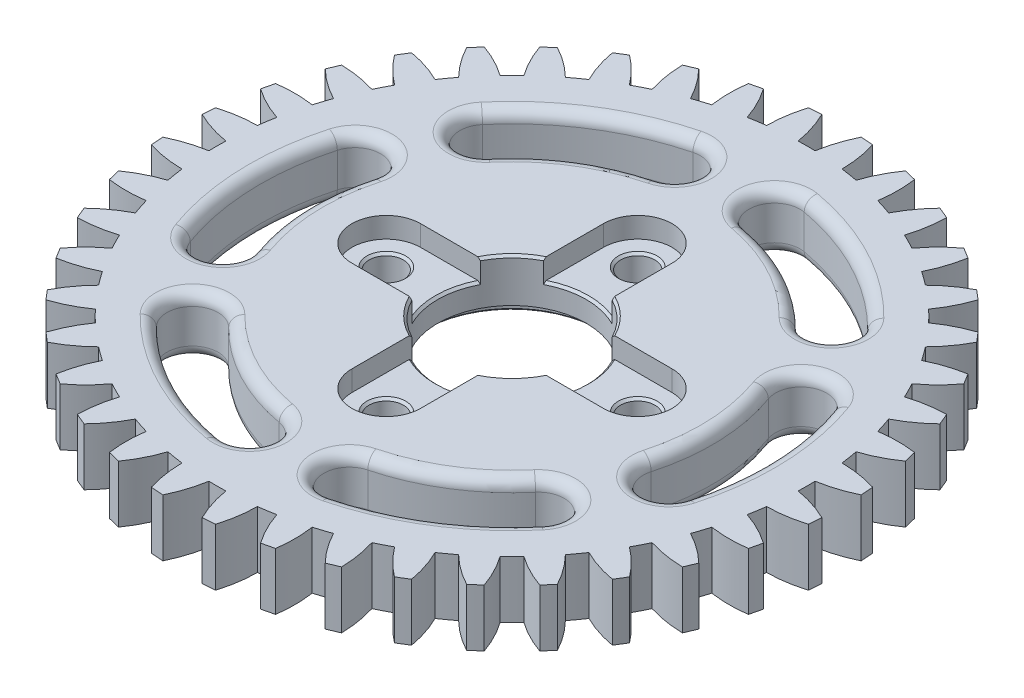
from build123d import *

# Parameters (mm, degrees)
SKETCH_2_R          = 1.5
SKETCH_2_R_2        = 6.5
EXTRUDE_2_DEPTH     = 5
CUT_EXTRUDE_1_DEPTH = 1.8
SKETCH_4_R          = 7.6
CUT_EXTRUDE_2_DEPTH = 1.2
CHAMFER_1_SIZE      = 0.2
FILLET_2_R          = 1


with BuildPart() as part:
    # 草图2 → 凸台-拉伸2 (new body)
    with BuildSketch(Plane(origin=(0, 0, 0), x_dir=(1, 0, 0), z_dir=(0, 1, 0))):
        with BuildLine():
            ThreePointArc((-0.73985828, 25.769631348), (-1.118469833, 27.332605136), (-1.7209274, 28.823671416))
            ThreePointArc((-1.7209274, 28.823671416), (-2.265506389, 28.785988012), (-2.80927569, 28.738016548))
            ThreePointArc((-2.80927569, 28.738016548), (-3.17106185, 27.171062641), (-3.300509097, 25.568103758))
            ThreePointArc((-3.300509097, 25.568103758), (-4.032919617, 25.462852343), (-4.762007891, 25.336625089))
            ThreePointArc((-4.762007891, 25.336625089), (-5.380461076, 26.821128181), (-6.208755546, 28.199591833))
            ThreePointArc((-6.208755546, 28.199591833), (-6.740734881, 28.077181451), (-7.27030509, 27.944736336))
            ThreePointArc((-7.27030509, 27.944736336), (-7.382511465, 26.340478408), (-7.259606987, 24.737004598))
            ThreePointArc((-7.259606987, 24.737004598), (-7.966535369, 24.518474754), (-8.666901064, 24.279747034))
            ThreePointArc((-8.666901064, 24.279747034), (-9.50996751, 25.649226036), (-10.543703526, 26.881144711))
            ThreePointArc((-10.543703526, 26.881144711), (-11.04998411, 26.677021501), (-11.552315449, 26.463363973))
            ThreePointArc((-11.552315449, 26.463363973), (-11.412179147, 24.861304177), (-11.039949259, 23.296798287))
            ThreePointArc((-11.039949259, 23.296798287), (-11.703988581, 22.970370945), (-12.358386368, 22.625021026))
            ThreePointArc((-12.358386368, 22.625021026), (-13.405306983, 23.845754821), (-14.619030531, 24.900794592))
            ThreePointArc((-14.619030531, 24.900794592), (-15.087146056, 24.619984746), (-15.549869462, 24.330375762))
            ThreePointArc((-15.549869462, 24.330375762), (-15.160841103, 22.769962128), (-14.548451341, 21.282947485))
            ThreePointArc((-14.548451341, 21.282947485), (-15.15325075, 20.856660369), (-15.745567185, 20.413191913))
            ThreePointArc((-15.745567185, 20.413191913), (-16.970563308, 21.455121983), (-18.334388488, 22.30730427))
            ThreePointArc((-18.334388488, 22.30730427), (-18.752812396, 21.956722257), (-19.164534082, 21.598292951))
            ThreePointArc((-19.164534082, 21.598292951), (-18.536192836, 20.117948042), (-17.698722268, 18.745039881))
            ThreePointArc((-17.698722268, 18.745039881), (-18.229389596, 18.229389596), (-18.745039881, 17.698722268))
            ThreePointArc((-18.745039881, 17.698722268), (-20.117948042, 18.536192836), (-21.598292951, 19.164534082))
            ThreePointArc((-21.598292951, 19.164534082), (-21.956722257, 18.752812396), (-22.30730427, 18.334388488))
            ThreePointArc((-22.30730427, 18.334388488), (-21.455121983, 16.970563308), (-20.413191913, 15.745567185))
            ThreePointArc((-20.413191913, 15.745567185), (-20.856660369, 15.15325075), (-21.282947485, 14.548451341))
            ThreePointArc((-21.282947485, 14.548451341), (-22.769962128, 15.160841103), (-24.330375762, 15.549869462))
            ThreePointArc((-24.330375762, 15.549869462), (-24.619984746, 15.087146056), (-24.900794592, 14.619030531))
            ThreePointArc((-24.900794592, 14.619030531), (-23.845754821, 13.405306983), (-22.625021026, 12.358386368))
            ThreePointArc((-22.625021026, 12.358386368), (-22.970370945, 11.703988581), (-23.296798287, 11.039949259))
            ThreePointArc((-23.296798287, 11.039949259), (-24.861304177, 11.412179147), (-26.463363973, 11.552315449))
            ThreePointArc((-26.463363973, 11.552315449), (-26.677021501, 11.04998411), (-26.881144711, 10.543703526))
            ThreePointArc((-26.881144711, 10.543703526), (-25.649226036, 9.50996751), (-24.279747034, 8.666901064))
            ThreePointArc((-24.279747034, 8.666901064), (-24.518474754, 7.966535369), (-24.737004598, 7.259606987))
            ThreePointArc((-24.737004598, 7.259606987), (-26.340478408, 7.382511465), (-27.944736336, 7.27030509))
            ThreePointArc((-27.944736336, 7.27030509), (-28.077181451, 6.740734881), (-28.199591833, 6.208755546))
            ThreePointArc((-28.199591833, 6.208755546), (-26.821128181, 5.380461076), (-25.336625089, 4.762007891))
            ThreePointArc((-25.336625089, 4.762007891), (-25.462852343, 4.032919617), (-25.568103758, 3.300509097))
            ThreePointArc((-25.568103758, 3.300509097), (-27.171062641, 3.17106185), (-28.738016548, 2.80927569))
            ThreePointArc((-28.738016548, 2.80927569), (-28.785988012, 2.265506389), (-28.823671416, 1.7209274))
            ThreePointArc((-28.823671416, 1.7209274), (-27.332605136, 1.118469833), (-25.769631348, 0.73985828))
            ThreePointArc((-25.769631348, 0.73985828), (-25.78025, 0), (-25.769631348, -0.73985828))
            ThreePointArc((-25.769631348, -0.73985828), (-27.332605136, -1.118469833), (-28.823671416, -1.7209274))
            ThreePointArc((-28.823671416, -1.7209274), (-28.785988012, -2.265506389), (-28.738016548, -2.80927569))
            ThreePointArc((-28.738016548, -2.80927569), (-27.171062641, -3.17106185), (-25.568103758, -3.300509097))
            ThreePointArc((-25.568103758, -3.300509097), (-25.462852343, -4.032919617), (-25.336625089, -4.762007891))
            ThreePointArc((-25.336625089, -4.762007891), (-26.821128181, -5.380461076), (-28.199591833, -6.208755546))
            ThreePointArc((-28.199591833, -6.208755546), (-28.077181451, -6.740734881), (-27.944736336, -7.27030509))
            ThreePointArc((-27.944736336, -7.27030509), (-26.340478408, -7.382511465), (-24.737004598, -7.259606987))
            ThreePointArc((-24.737004598, -7.259606987), (-24.518474754, -7.966535369), (-24.279747034, -8.666901064))
            ThreePointArc((-24.279747034, -8.666901064), (-25.649226036, -9.50996751), (-26.881144711, -10.543703526))
            ThreePointArc((-26.881144711, -10.543703526), (-26.677021501, -11.04998411), (-26.463363973, -11.552315449))
            ThreePointArc((-26.463363973, -11.552315449), (-24.861304177, -11.412179147), (-23.296798287, -11.039949259))
            ThreePointArc((-23.296798287, -11.039949259), (-22.970370945, -11.703988581), (-22.625021026, -12.358386368))
            ThreePointArc((-22.625021026, -12.358386368), (-23.845754821, -13.405306983), (-24.900794592, -14.619030531))
            ThreePointArc((-24.900794592, -14.619030531), (-24.619984746, -15.087146056), (-24.330375762, -15.549869462))
            ThreePointArc((-24.330375762, -15.549869462), (-22.769962128, -15.160841103), (-21.282947485, -14.548451341))
            ThreePointArc((-21.282947485, -14.548451341), (-20.856660369, -15.15325075), (-20.413191913, -15.745567185))
            ThreePointArc((-20.413191913, -15.745567185), (-21.455121983, -16.970563308), (-22.30730427, -18.334388488))
            ThreePointArc((-22.30730427, -18.334388488), (-21.956722257, -18.752812396), (-21.598292951, -19.164534082))
            ThreePointArc((-21.598292951, -19.164534082), (-20.117948042, -18.536192836), (-18.745039881, -17.698722268))
            ThreePointArc((-18.745039881, -17.698722268), (-18.229389596, -18.229389596), (-17.698722268, -18.745039881))
            ThreePointArc((-17.698722268, -18.745039881), (-18.536192836, -20.117948042), (-19.164534082, -21.598292951))
            ThreePointArc((-19.164534082, -21.598292951), (-18.752812396, -21.956722257), (-18.334388488, -22.30730427))
            ThreePointArc((-18.334388488, -22.30730427), (-16.970563308, -21.455121983), (-15.745567185, -20.413191913))
            ThreePointArc((-15.745567185, -20.413191913), (-15.15325075, -20.856660369), (-14.548451341, -21.282947485))
            ThreePointArc((-14.548451341, -21.282947485), (-15.160841103, -22.769962128), (-15.549869462, -24.330375762))
            ThreePointArc((-15.549869462, -24.330375762), (-15.087146056, -24.619984746), (-14.619030531, -24.900794592))
            ThreePointArc((-14.619030531, -24.900794592), (-13.405306983, -23.845754821), (-12.358386368, -22.625021026))
            ThreePointArc((-12.358386368, -22.625021026), (-11.703988581, -22.970370945), (-11.039949259, -23.296798287))
            ThreePointArc((-11.039949259, -23.296798287), (-11.412179147, -24.861304177), (-11.552315449, -26.463363973))
            ThreePointArc((-11.552315449, -26.463363973), (-11.04998411, -26.677021501), (-10.543703526, -26.881144711))
            ThreePointArc((-10.543703526, -26.881144711), (-9.50996751, -25.649226036), (-8.666901064, -24.279747034))
            ThreePointArc((-8.666901064, -24.279747034), (-7.966535369, -24.518474754), (-7.259606987, -24.737004598))
            ThreePointArc((-7.259606987, -24.737004598), (-7.382511465, -26.340478408), (-7.27030509, -27.944736336))
            ThreePointArc((-7.27030509, -27.944736336), (-6.740734881, -28.077181451), (-6.208755546, -28.199591833))
            ThreePointArc((-6.208755546, -28.199591833), (-5.380461076, -26.821128181), (-4.762007891, -25.336625089))
            ThreePointArc((-4.762007891, -25.336625089), (-4.032919617, -25.462852343), (-3.300509097, -25.568103758))
            ThreePointArc((-3.300509097, -25.568103758), (-3.17106185, -27.171062641), (-2.80927569, -28.738016548))
            ThreePointArc((-2.80927569, -28.738016548), (-2.265506389, -28.785988012), (-1.7209274, -28.823671416))
            ThreePointArc((-1.7209274, -28.823671416), (-1.118469833, -27.332605136), (-0.73985828, -25.769631348))
            ThreePointArc((-0.73985828, -25.769631348), (0, -25.78025), (0.73985828, -25.769631348))
            ThreePointArc((0.73985828, -25.769631348), (1.118469833, -27.332605136), (1.7209274, -28.823671416))
            ThreePointArc((1.7209274, -28.823671416), (2.265506389, -28.785988012), (2.80927569, -28.738016548))
            ThreePointArc((2.80927569, -28.738016548), (3.17106185, -27.171062641), (3.300509097, -25.568103758))
            ThreePointArc((3.300509097, -25.568103758), (4.032919617, -25.462852343), (4.762007891, -25.336625089))
            ThreePointArc((4.762007891, -25.336625089), (5.380461076, -26.821128181), (6.208755546, -28.199591833))
            ThreePointArc((6.208755546, -28.199591833), (6.740734881, -28.077181451), (7.27030509, -27.944736336))
            ThreePointArc((7.27030509, -27.944736336), (7.382511465, -26.340478408), (7.259606987, -24.737004598))
            ThreePointArc((7.259606987, -24.737004598), (7.966535369, -24.518474754), (8.666901064, -24.279747034))
            ThreePointArc((8.666901064, -24.279747034), (9.50996751, -25.649226036), (10.543703526, -26.881144711))
            ThreePointArc((10.543703526, -26.881144711), (11.04998411, -26.677021501), (11.552315449, -26.463363973))
            ThreePointArc((11.552315449, -26.463363973), (11.412179147, -24.861304177), (11.039949259, -23.296798287))
            ThreePointArc((11.039949259, -23.296798287), (11.703988581, -22.970370945), (12.358386368, -22.625021026))
            ThreePointArc((12.358386368, -22.625021026), (13.405306983, -23.845754821), (14.619030531, -24.900794592))
            ThreePointArc((14.619030531, -24.900794592), (15.087146056, -24.619984746), (15.549869462, -24.330375762))
            ThreePointArc((15.549869462, -24.330375762), (15.160841103, -22.769962128), (14.548451341, -21.282947485))
            ThreePointArc((14.548451341, -21.282947485), (15.15325075, -20.856660369), (15.745567185, -20.413191913))
            ThreePointArc((15.745567185, -20.413191913), (16.970563308, -21.455121983), (18.334388488, -22.30730427))
            ThreePointArc((18.334388488, -22.30730427), (18.752812396, -21.956722257), (19.164534082, -21.598292951))
            ThreePointArc((19.164534082, -21.598292951), (18.536192836, -20.117948042), (17.698722268, -18.745039881))
            ThreePointArc((17.698722268, -18.745039881), (18.229389596, -18.229389596), (18.745039881, -17.698722268))
            ThreePointArc((18.745039881, -17.698722268), (20.117948042, -18.536192836), (21.598292951, -19.164534082))
            ThreePointArc((21.598292951, -19.164534082), (21.956722257, -18.752812396), (22.30730427, -18.334388488))
            ThreePointArc((22.30730427, -18.334388488), (21.455121983, -16.970563308), (20.413191913, -15.745567185))
            ThreePointArc((20.413191913, -15.745567185), (20.856660369, -15.15325075), (21.282947485, -14.548451341))
            ThreePointArc((21.282947485, -14.548451341), (22.769962128, -15.160841103), (24.330375762, -15.549869462))
            ThreePointArc((24.330375762, -15.549869462), (24.619984746, -15.087146056), (24.900794592, -14.619030531))
            ThreePointArc((24.900794592, -14.619030531), (23.845754821, -13.405306983), (22.625021026, -12.358386368))
            ThreePointArc((22.625021026, -12.358386368), (22.970370945, -11.703988581), (23.296798287, -11.039949259))
            ThreePointArc((23.296798287, -11.039949259), (24.861304177, -11.412179147), (26.463363973, -11.552315449))
            ThreePointArc((26.463363973, -11.552315449), (26.677021501, -11.04998411), (26.881144711, -10.543703526))
            ThreePointArc((26.881144711, -10.543703526), (25.649226036, -9.50996751), (24.279747034, -8.666901064))
            ThreePointArc((24.279747034, -8.666901064), (24.518474754, -7.966535369), (24.737004598, -7.259606987))
            ThreePointArc((24.737004598, -7.259606987), (26.340478408, -7.382511465), (27.944736336, -7.27030509))
            ThreePointArc((27.944736336, -7.27030509), (28.077181451, -6.740734881), (28.199591833, -6.208755546))
            ThreePointArc((28.199591833, -6.208755546), (26.821128181, -5.380461076), (25.336625089, -4.762007891))
            ThreePointArc((25.336625089, -4.762007891), (25.462852343, -4.032919617), (25.568103758, -3.300509097))
            ThreePointArc((25.568103758, -3.300509097), (27.171062641, -3.17106185), (28.738016548, -2.80927569))
            ThreePointArc((28.738016548, -2.80927569), (28.785988012, -2.265506389), (28.823671416, -1.7209274))
            ThreePointArc((28.823671416, -1.7209274), (27.332605136, -1.118469833), (25.769631348, -0.73985828))
            ThreePointArc((25.769631348, -0.73985828), (25.78025, 0), (25.769631348, 0.73985828))
            ThreePointArc((25.769631348, 0.73985828), (27.332605136, 1.118469833), (28.823671416, 1.7209274))
            ThreePointArc((28.823671416, 1.7209274), (28.785988012, 2.265506389), (28.738016548, 2.80927569))
            ThreePointArc((28.738016548, 2.80927569), (27.171062641, 3.17106185), (25.568103758, 3.300509097))
            ThreePointArc((25.568103758, 3.300509097), (25.462852343, 4.032919617), (25.336625089, 4.762007891))
            ThreePointArc((25.336625089, 4.762007891), (26.821128181, 5.380461076), (28.199591833, 6.208755546))
            ThreePointArc((28.199591833, 6.208755546), (28.077181451, 6.740734881), (27.944736336, 7.27030509))
            ThreePointArc((27.944736336, 7.27030509), (26.340478408, 7.382511465), (24.737004598, 7.259606987))
            ThreePointArc((24.737004598, 7.259606987), (24.518474754, 7.966535369), (24.279747034, 8.666901064))
            ThreePointArc((24.279747034, 8.666901064), (25.649226036, 9.50996751), (26.881144711, 10.543703526))
            ThreePointArc((26.881144711, 10.543703526), (26.677021501, 11.04998411), (26.463363973, 11.552315449))
            ThreePointArc((26.463363973, 11.552315449), (24.861304177, 11.412179147), (23.296798287, 11.039949259))
            ThreePointArc((23.296798287, 11.039949259), (22.970370945, 11.703988581), (22.625021026, 12.358386368))
            ThreePointArc((22.625021026, 12.358386368), (23.845754821, 13.405306983), (24.900794592, 14.619030531))
            ThreePointArc((24.900794592, 14.619030531), (24.619984746, 15.087146056), (24.330375762, 15.549869462))
            ThreePointArc((24.330375762, 15.549869462), (22.769962128, 15.160841103), (21.282947485, 14.548451341))
            ThreePointArc((21.282947485, 14.548451341), (20.856660369, 15.15325075), (20.413191913, 15.745567185))
            ThreePointArc((20.413191913, 15.745567185), (21.455121983, 16.970563308), (22.30730427, 18.334388488))
            ThreePointArc((22.30730427, 18.334388488), (21.956722257, 18.752812396), (21.598292951, 19.164534082))
            ThreePointArc((21.598292951, 19.164534082), (20.117948042, 18.536192836), (18.745039881, 17.698722268))
            ThreePointArc((18.745039881, 17.698722268), (18.229389596, 18.229389596), (17.698722268, 18.745039881))
            ThreePointArc((17.698722268, 18.745039881), (18.536192836, 20.117948042), (19.164534082, 21.598292951))
            ThreePointArc((19.164534082, 21.598292951), (18.752812396, 21.956722257), (18.334388488, 22.30730427))
            ThreePointArc((18.334388488, 22.30730427), (16.970563308, 21.455121983), (15.745567185, 20.413191913))
            ThreePointArc((15.745567185, 20.413191913), (15.15325075, 20.856660369), (14.548451341, 21.282947485))
            ThreePointArc((14.548451341, 21.282947485), (15.160841103, 22.769962128), (15.549869462, 24.330375762))
            ThreePointArc((15.549869462, 24.330375762), (15.087146056, 24.619984746), (14.619030531, 24.900794592))
            ThreePointArc((14.619030531, 24.900794592), (13.405306983, 23.845754821), (12.358386368, 22.625021026))
            ThreePointArc((12.358386368, 22.625021026), (11.703988581, 22.970370945), (11.039949259, 23.296798287))
            ThreePointArc((11.039949259, 23.296798287), (11.412179147, 24.861304177), (11.552315449, 26.463363973))
            ThreePointArc((11.552315449, 26.463363973), (11.04998411, 26.677021501), (10.543703526, 26.881144711))
            ThreePointArc((10.543703526, 26.881144711), (9.50996751, 25.649226036), (8.666901064, 24.279747034))
            ThreePointArc((8.666901064, 24.279747034), (7.966535369, 24.518474754), (7.259606987, 24.737004598))
            ThreePointArc((7.259606987, 24.737004598), (7.382511465, 26.340478408), (7.27030509, 27.944736336))
            ThreePointArc((7.27030509, 27.944736336), (6.740734881, 28.077181451), (6.208755546, 28.199591833))
            ThreePointArc((6.208755546, 28.199591833), (5.380461076, 26.821128181), (4.762007891, 25.336625089))
            ThreePointArc((4.762007891, 25.336625089), (4.032919617, 25.462852343), (3.300509097, 25.568103758))
            ThreePointArc((3.300509097, 25.568103758), (3.17106185, 27.171062641), (2.80927569, 28.738016548))
            ThreePointArc((2.80927569, 28.738016548), (2.265506389, 28.785988012), (1.7209274, 28.823671416))
            ThreePointArc((1.7209274, 28.823671416), (1.118469833, 27.332605136), (0.73985828, 25.769631348))
            ThreePointArc((0.73985828, 25.769631348), (0, 25.78025), (-0.73985828, 25.769631348))
        make_face()
        with Locations(Location((0, -11, 0), (0, 0, 270))):
            Circle(SKETCH_2_R, mode=Mode.SUBTRACT)
        with Locations(Location((0, 0, 0), (0, 0, 270))):
            Circle(SKETCH_2_R_2, mode=Mode.SUBTRACT)
        with Locations(Location((-11, 0, 0), (0, 0, 270))):
            Circle(SKETCH_2_R, mode=Mode.SUBTRACT)
        with Locations(Location((0, 11, 0), (0, 0, 270))):
            Circle(SKETCH_2_R, mode=Mode.SUBTRACT)
        with Locations(Location((11, 0, 0), (0, 0, 270))):
            Circle(SKETCH_2_R, mode=Mode.SUBTRACT)
        with BuildLine():
            ThreePointArc((5.478230054, -21.307017517), (11.688327214, -18.63821362), (16.795089248, -14.210030864))
            ThreePointArc((16.795089248, -14.210030864), (16.532271894, -11.057806654), (13.380047684, -11.320624008))
            ThreePointArc((13.380047684, -11.320624008), (9.311672786, -14.848399035), (4.364310202, -16.974539771))
            ThreePointArc((4.364310202, -16.974539771), (2.755031255, -19.69773857), (5.478230054, -21.307017517))
        make_face(mode=Mode.SUBTRACT)
        with BuildLine():
            ThreePointArc((-12.518227558, -12.266873391), (-8.203254377, -15.488344702), (-3.113924136, -17.247773203))
            ThreePointArc((-3.113924136, -17.247773203), (-1.310205526, -19.84627077), (-3.908703093, -21.649989379))
            ThreePointArc((-3.908703093, -21.649989379), (-10.297002868, -19.441495105), (-15.713303422, -15.397795153))
            ThreePointArc((-15.713303422, -15.397795153), (-15.681226371, -12.23479634), (-12.518227558, -12.266873391))
        make_face(mode=Mode.SUBTRACT)
        with BuildLine():
            ThreePointArc((-16.88253776, 4.70766638), (-17.514927163, -0.639945666), (-16.49397182, -5.927149195))
            ThreePointArc((-16.49397182, -5.927149195), (-17.84247742, -8.788464115), (-20.703792341, -7.439958515))
            ThreePointArc((-20.703792341, -7.439958515), (-21.985330083, -0.803281486), (-21.191533476, 5.909222364))
            ThreePointArc((-21.191533476, 5.909222364), (-18.436257626, 7.46294223), (-16.88253776, 4.70766638))
        make_face(mode=Mode.SUBTRACT)
        with BuildLine():
            ThreePointArc((-4.364310202, 16.974539771), (-9.311672786, 14.848399035), (-13.380047684, 11.320624008))
            ThreePointArc((-13.380047684, 11.320624008), (-16.532271894, 11.057806654), (-16.795089248, 14.210030864))
            ThreePointArc((-16.795089248, 14.210030864), (-11.688327214, 18.63821362), (-5.478230054, 21.307017517))
            ThreePointArc((-5.478230054, 21.307017517), (-2.755031255, 19.69773857), (-4.364310202, 16.974539771))
        make_face(mode=Mode.SUBTRACT)
        with BuildLine():
            ThreePointArc((12.518227558, 12.266873391), (8.203254377, 15.488344702), (3.113924136, 17.247773203))
            ThreePointArc((3.113924136, 17.247773203), (1.310205526, 19.84627077), (3.908703093, 21.649989379))
            ThreePointArc((3.908703093, 21.649989379), (10.297002868, 19.441495105), (15.713303422, 15.397795153))
            ThreePointArc((15.713303422, 15.397795153), (15.681226371, 12.23479634), (12.518227558, 12.266873391))
        make_face(mode=Mode.SUBTRACT)
        with BuildLine():
            ThreePointArc((16.88253776, -4.70766638), (17.514927163, 0.639945666), (16.49397182, 5.927149195))
            ThreePointArc((16.49397182, 5.927149195), (17.84247742, 8.788464115), (20.703792341, 7.439958515))
            ThreePointArc((20.703792341, 7.439958515), (21.985330083, 0.803281486), (21.191533476, -5.909222364))
            ThreePointArc((21.191533476, -5.909222364), (18.436257626, -7.46294223), (16.88253776, -4.70766638))
        make_face(mode=Mode.SUBTRACT)
    extrude(amount=EXTRUDE_2_DEPTH)

    # 草图3 → 切除-拉伸1 (cut)
    with BuildSketch(Plane(origin=(0, 5, 0), x_dir=(1, 0, 0), z_dir=(0, 1, 0))):
        with BuildLine():
            Line((-3, 11), (-3, 5.253808143))
            ThreePointArc((-3, 5.253808143), (0, 6.05), (3, 5.253808143))
            Line((3, 5.253808143), (3, 11))
            ThreePointArc((3, 11), (0, 14), (-3, 11))
        make_face()
        with BuildLine():
            ThreePointArc((6.05, 0), (5.847565274, -1.551927952), (5.253808143, -3))
            Line((5.253808143, -3), (11, -3))
            ThreePointArc((11, -3), (14, 0), (11, 3))
            Line((11, 3), (5.253808143, 3))
            ThreePointArc((5.253808143, 3), (5.847565274, 1.551927952), (6.05, 0))
        make_face()
        with BuildLine():
            Line((-11, -3), (-5.253808143, -3))
            ThreePointArc((-5.253808143, -3), (-6.05, 0), (-5.253808143, 3))
            Line((-5.253808143, 3), (-11, 3))
            ThreePointArc((-11, 3), (-14, 0), (-11, -3))
        make_face()
        with BuildLine():
            ThreePointArc((-3, -11), (0, -14), (3, -11))
            Line((3, -11), (3, -5.253808143))
            ThreePointArc((3, -5.253808143), (0, -6.05), (-3, -5.253808143))
            Line((-3, -5.253808143), (-3, -11))
        make_face()
    extrude(amount=-CUT_EXTRUDE_1_DEPTH, mode=Mode.SUBTRACT)

    # 草图4 → 切除-拉伸2 (cut)
    with BuildSketch(Plane.XZ):
        with Locations(Location((0, 0, 0), (0, 0, 270))):
            Circle(SKETCH_4_R)
    extrude(amount=-CUT_EXTRUDE_2_DEPTH, mode=Mode.SUBTRACT)

    # 倒角1
    chamfer_1_edges = [part.edges().sort_by_distance(p)[0] for p in [
        (4.596194078, 5, 4.596194078),
        (11, 0, -1.5),
        (0, 0, -12.5),
        (-11, 0, -1.5),
        (0, 0, 9.5),
        (4.596194078, 5, -4.596194078),
        (-4.596194078, 5, -4.596194078),
        (-4.596194078, 5, 4.596194078),
        (-6.5, 3.2, 0),
        (6.5, 3.2, 0),
        (0, 3.2, -6.5),
        (0, 3.2, -12.5),
        (11, 3.2, -1.5),
        (-11, 3.2, -1.5),
        (0, 3.2, 9.5),
        (1.544210408, 3.2, 6.313906415),
        (0, 0, 7.6),
    ]]
    chamfer(chamfer_1_edges, length=CHAMFER_1_SIZE)

    # 圆角2
    fillet_2_edges = [part.edges().sort_by_distance(p)[0] for p in [
        (10.297002868, 5, -19.441495105),
        (15.681226371, 5, -12.23479634),
        (8.203254377, 5, -15.488344702),
        (1.310205526, 5, -19.84627077),
        (21.985330083, 5, -0.803281486),
        (18.436257626, 5, 7.46294223),
        (17.514927163, 5, -0.639945666),
        (17.84247742, 5, -8.788464115),
        (16.532271894, 5, 11.057806654),
        (11.688327214, 5, 18.63821362),
        (17.84247742, 0, -8.788464115),
        (17.514927163, 0, -0.639945666),
        (18.436257626, 0, 7.46294223),
        (21.985330083, 0, -0.803281486),
        (1.310205526, 0, -19.84627077),
        (8.203254377, 0, -15.488344702),
        (15.681226371, 0, -12.23479634),
        (10.297002868, 0, -19.441495105),
        (-16.532271894, 0, -11.057806654),
        (-9.311672786, 0, -14.848399035),
        (-2.755031255, 0, -19.69773857),
        (-11.688327214, 0, -18.63821362),
        (-17.84247742, 0, 8.788464115),
        (-17.514927163, 0, 0.639945666),
        (-18.436257626, 0, -7.46294223),
        (-21.985330083, 0, 0.803281486),
        (-1.310205526, 0, 19.84627077),
        (-8.203254377, 0, 15.488344702),
        (-15.681226371, 0, 12.23479634),
        (-10.297002868, 0, 19.441495105),
        (9.311672786, 0, 14.848399035),
        (2.755031255, 0, 19.69773857),
        (11.688327214, 0, 18.63821362),
        (16.532271894, 0, 11.057806654),
        (2.755031255, 5, 19.69773857),
        (9.311672786, 5, 14.848399035),
        (-10.297002868, 5, 19.441495105),
        (-15.681226371, 5, 12.23479634),
        (-8.203254377, 5, 15.488344702),
        (-1.310205526, 5, 19.84627077),
        (-21.985330083, 5, 0.803281486),
        (-18.436257626, 5, -7.46294223),
        (-17.514927163, 5, 0.639945666),
        (-17.84247742, 5, 8.788464115),
        (-11.688327214, 5, -18.63821362),
        (-2.755031255, 5, -19.69773857),
        (-9.311672786, 5, -14.848399035),
        (-16.532271894, 5, -11.057806654),
    ]]
    fillet(fillet_2_edges, radius=FILLET_2_R)


solid = part.part
